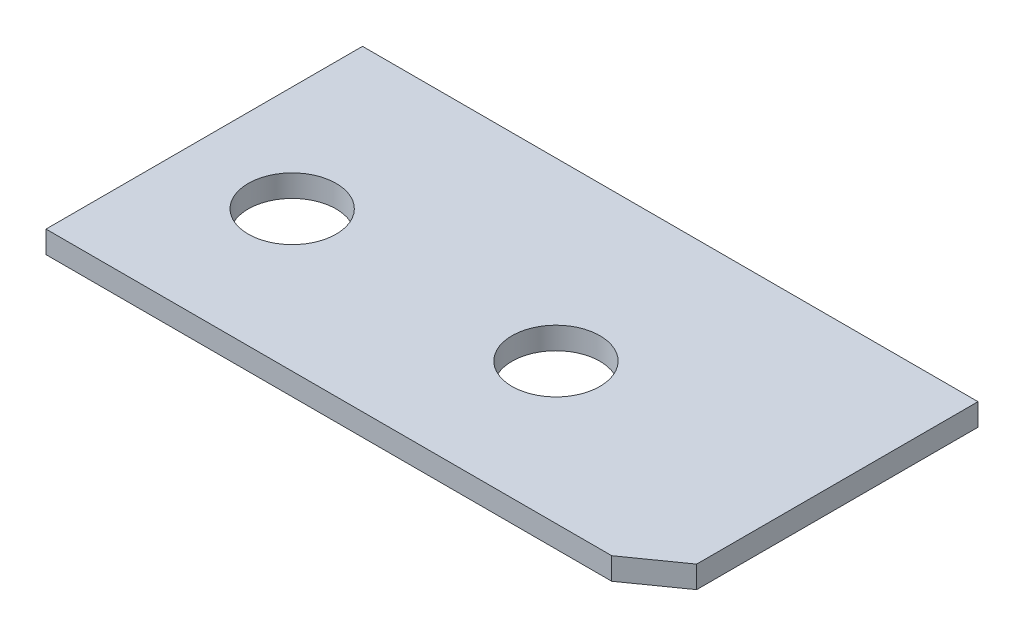
from build123d import *

# Parameters (mm, degrees)
ESBO_O1_R                = 2.5
RESSALTO_EXTRUS_O1_DEPTH = 1.26


with BuildPart() as part:
    # Esboço1 → Ressalto-extrusão1 (new body)
    with BuildSketch(Plane(origin=(0, 0, 0), x_dir=(1, 0, 0), z_dir=(0, 1, 0))):
        Polygon((-17.5, -9), (14.671572875, -9), (17.5, -7), (17.5, 9), (-17.5, 9), align=None)
        with Locations(Location((3.5, -1, 0), (0, 0, 270))):
            Circle(ESBO_O1_R, mode=Mode.SUBTRACT)
        with Locations(Location((-11.5, -1, 0), (0, 0, 270))):
            Circle(ESBO_O1_R, mode=Mode.SUBTRACT)
    extrude(amount=RESSALTO_EXTRUS_O1_DEPTH)


solid = part.part
